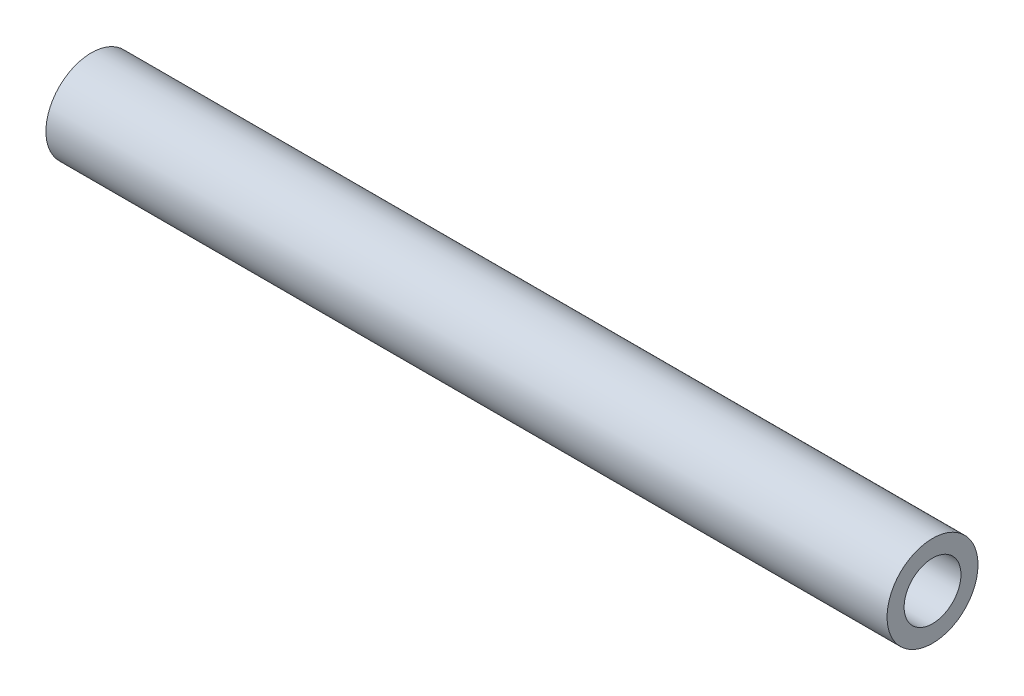
from build123d import *

# Parameters (mm, degrees)
SKETCH1_R           = 4
BOSS_EXTRUDE1_DEPTH = 37
SKETCH2_R           = 2.5
CUT_EXTRUDE1_DEPTH  = 15


with BuildPart() as part:
    # Sketch1 → Boss-Extrude1 (new, symmetric)
    with BuildSketch(Plane(origin=(0, 0, 0), x_dir=(0, 0, -1), z_dir=(1, 0, 0))):
        Circle(SKETCH1_R)
    extrude(amount=BOSS_EXTRUDE1_DEPTH, both=True)

    # Sketch2 → Cut-Extrude1 (cut)
    with BuildSketch(Plane(origin=(37, 0, 0), x_dir=(0, 0, -1), z_dir=(1, 0, 0))):
        Circle(SKETCH2_R)
    cut_extrude1 = extrude(amount=-CUT_EXTRUDE1_DEPTH, mode=Mode.SUBTRACT)

    # Mirror1: Cut-Extrude1 across plane
    add(cut_extrude1.mirror(Plane(origin=(0, 0, 0), x_dir=(0, 0, 1), z_dir=(1, 0, 0))), mode=Mode.SUBTRACT)


solid = part.part
